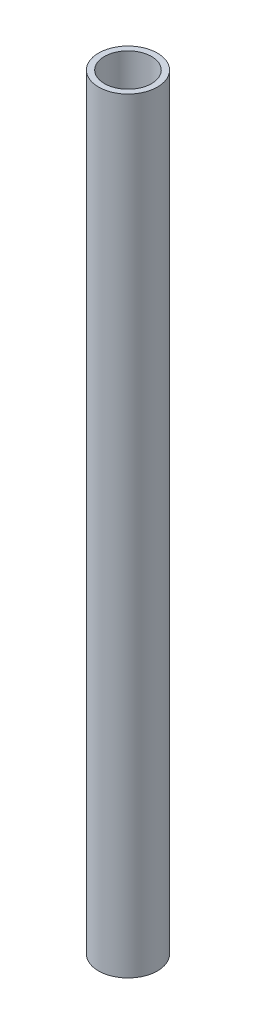
from build123d import *

# Parameters (mm, degrees)
SKETCH_1_R      = 10
SKETCH_1_R_2    = 8
EXTRUDE_1_DEPTH = 260


with BuildPart() as part:
    # 草图1 → 凸台-拉伸1 (new body)
    with BuildSketch(Plane(origin=(0, 0, 0), x_dir=(1, 0, 0), z_dir=(0, 1, 0))):
        with Locations(Location((0, 0, 0), (0, 0, 270))):
            Circle(SKETCH_1_R)
        with Locations(Location((0, 0, 0), (0, 0, 270))):
            Circle(SKETCH_1_R_2, mode=Mode.SUBTRACT)
    extrude(amount=EXTRUDE_1_DEPTH)


solid = part.part
